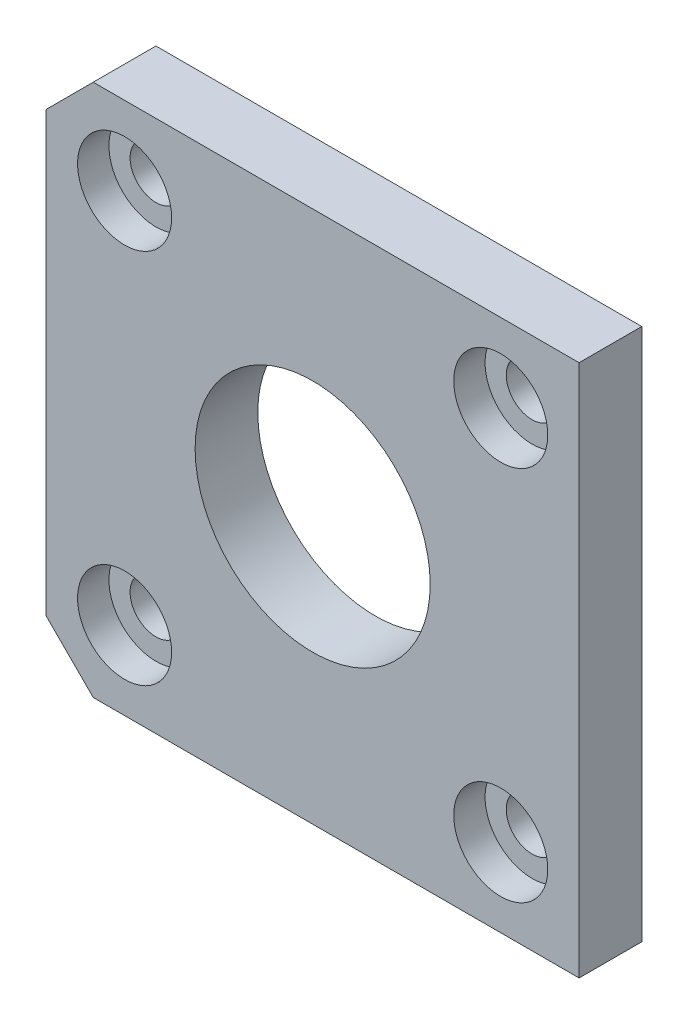
from build123d import *

# Parameters (mm, degrees)
SKETCH_1_R          = 7.5
SKETCH_1_R_2        = 1.65
EXTRUDE_1_DEPTH     = 4
SKETCH_2_R          = 3
CUT_EXTRUDE_1_DEPTH = 2


with BuildPart() as part:
    # 草图1 → 凸台-拉伸1 (new body)
    with BuildSketch(Plane.XY):
        Polygon((0, 31), (3, 34), (34, 34), (34, 0), (3, 0), (0, 3), align=None)
        with Locations((17, 17)):
            Circle(SKETCH_1_R, mode=Mode.SUBTRACT)
        with Locations((5, 29)):
            Circle(SKETCH_1_R_2, mode=Mode.SUBTRACT)
        with Locations((29, 29)):
            Circle(SKETCH_1_R_2, mode=Mode.SUBTRACT)
        with Locations((5, 5)):
            Circle(SKETCH_1_R_2, mode=Mode.SUBTRACT)
        with Locations((29, 5)):
            Circle(SKETCH_1_R_2, mode=Mode.SUBTRACT)
    extrude(amount=EXTRUDE_1_DEPTH)

    # 草图2 → 切除-拉伸1 (cut)
    with BuildSketch(Plane.XY.offset(4)):
        with Locations((5, 29)):
            Circle(SKETCH_2_R)
        with Locations((29, 29)):
            Circle(SKETCH_2_R)
        with Locations((5, 5)):
            Circle(SKETCH_2_R)
        with Locations((29, 5)):
            Circle(SKETCH_2_R)
    extrude(amount=-CUT_EXTRUDE_1_DEPTH, mode=Mode.SUBTRACT)


solid = part.part
